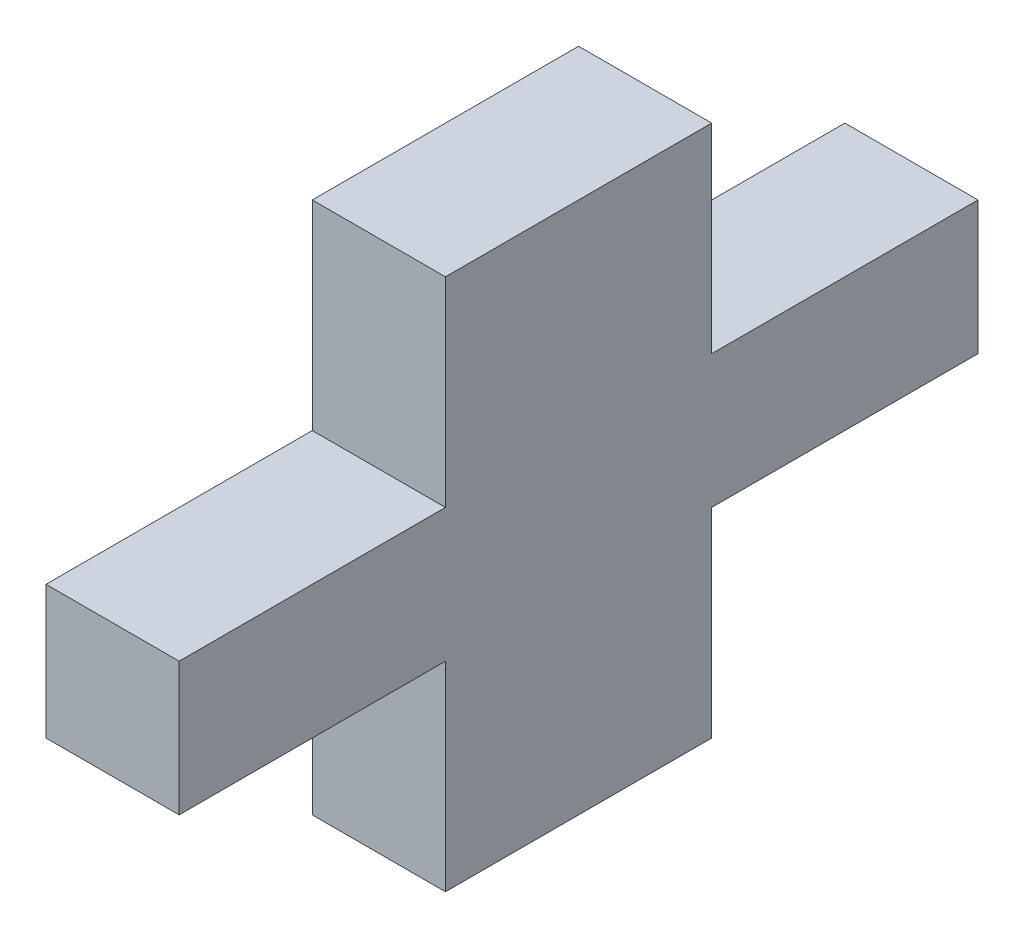
from build123d import *

# Parameters (mm, degrees)
BOSS_EXTRUDE2_DEPTH = 10


with BuildPart() as part:
    # Sketch3 → Boss-Extrude2 (new body)
    with BuildSketch(Plane(origin=(0, 0, 0), x_dir=(0, 0, -1), z_dir=(1, 0, 0))):
        Polygon((10, 20), (-10, 20), (-10, 5), (-30, 5), (-30, -5), (-10, -5), (-10, -20), (10, -20), (10, -5), (30, -5), (30, 5), (10, 5), align=None)
    extrude(amount=BOSS_EXTRUDE2_DEPTH)


solid = part.part
